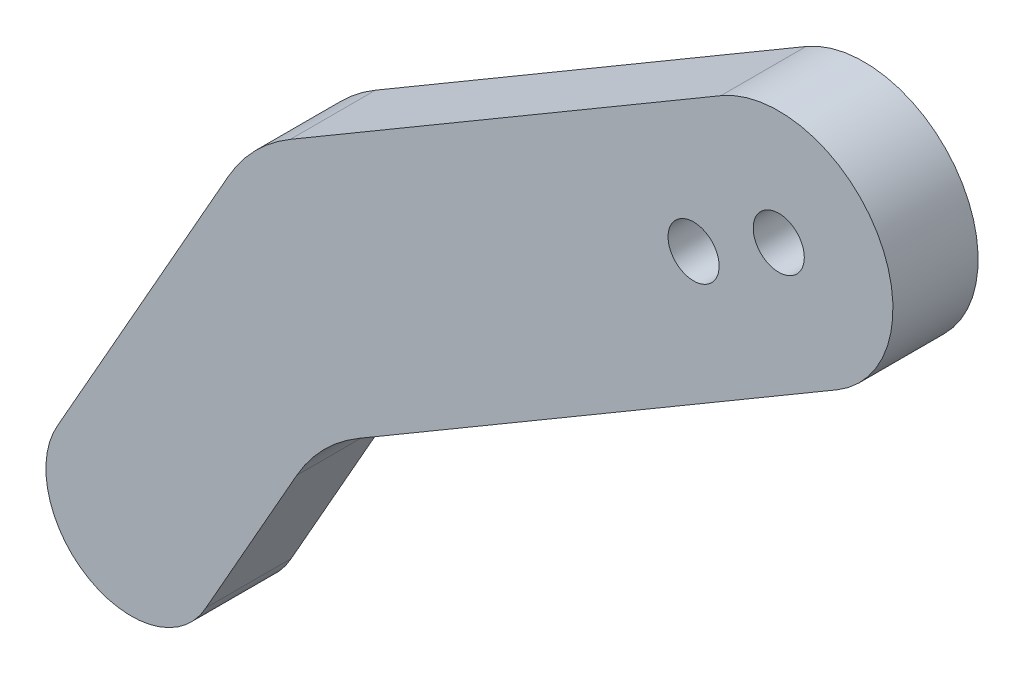
from build123d import *

# Parameters (mm, degrees)
BOSS_EXTRUDE1_DEPTH = 5
SKETCH4_R           = 1.5
CUT_EXTRUDE1_DEPTH  = 7


with BuildPart() as part:
    # Sketch3 → Boss-Extrude1 (new body)
    with BuildSketch(Plane.XY):
        with BuildLine():
            Line((0, 0), (10.022000848, 17.677175891))
            ThreePointArc((10.022000848, 17.677175891), (11.594904359, 19.760636782), (13.653451842, 21.366008079))
            Line((13.653451842, 21.366008079), (38.93006343, 36.224847214))
            ThreePointArc((38.93006343, 36.224847214), (48.1083933, 33.842470777), (45.726016863, 24.664140908))
            Line((45.726016863, 24.664140908), (17.667266386, 8.169823297))
            ThreePointArc((17.667266386, 8.169823297), (15.608718903, 6.564451999), (14.035815391, 4.480991108))
            Line((14.035815391, 4.480991108), (8.699180072, -4.931963714))
            ThreePointArc((8.699180072, -4.931963714), (1.838948591, -6.894344126), (0, 0))
        make_face()
    extrude(amount=BOSS_EXTRUDE1_DEPTH)

    # Sketch4 → Cut-Extrude1 (cut)
    with BuildSketch(Plane.XY.offset(5)):
        with Locations((42.328040147, 30.444494061)):
            Circle(SKETCH4_R)
        with Locations((37.328040147, 27.505247421)):
            Circle(SKETCH4_R)
    extrude(amount=-CUT_EXTRUDE1_DEPTH, mode=Mode.SUBTRACT)


solid = part.part
